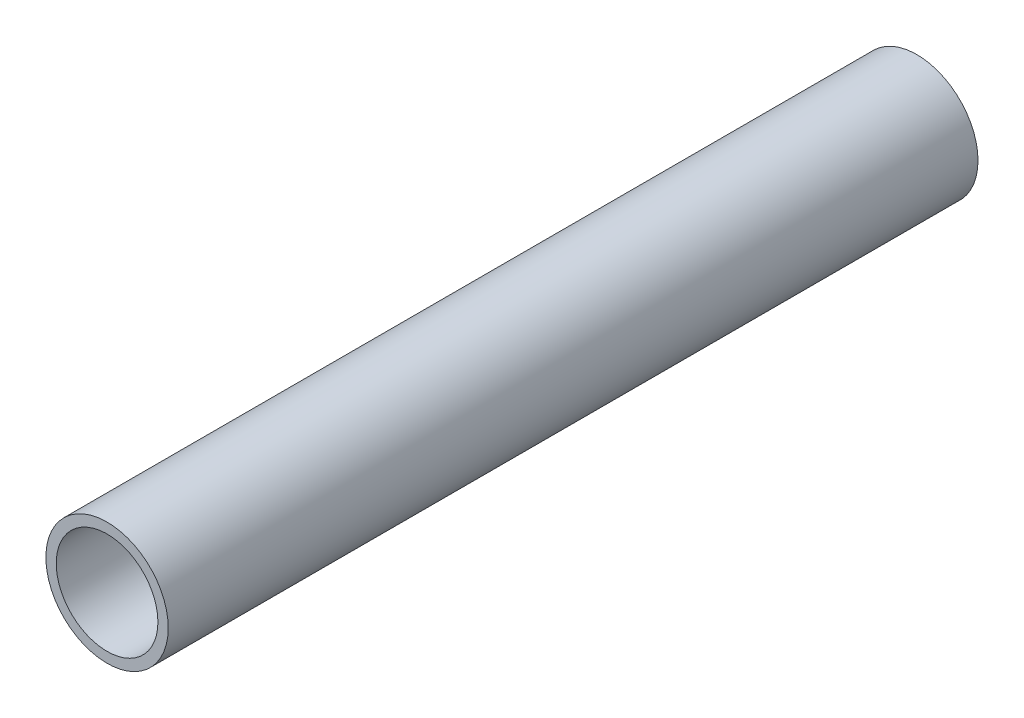
from build123d import *

# Parameters (mm, degrees)
SKETCH1_R           = 5.715
SKETCH1_R_2         = 4.7498
BOSS_EXTRUDE1_DEPTH = 75.6412


with BuildPart() as part:
    # Sketch1 → Boss-Extrude1 (new body)
    with BuildSketch(Plane.XY):
        Circle(SKETCH1_R)
        Circle(SKETCH1_R_2, mode=Mode.SUBTRACT)
    extrude(amount=BOSS_EXTRUDE1_DEPTH)


solid = part.part
